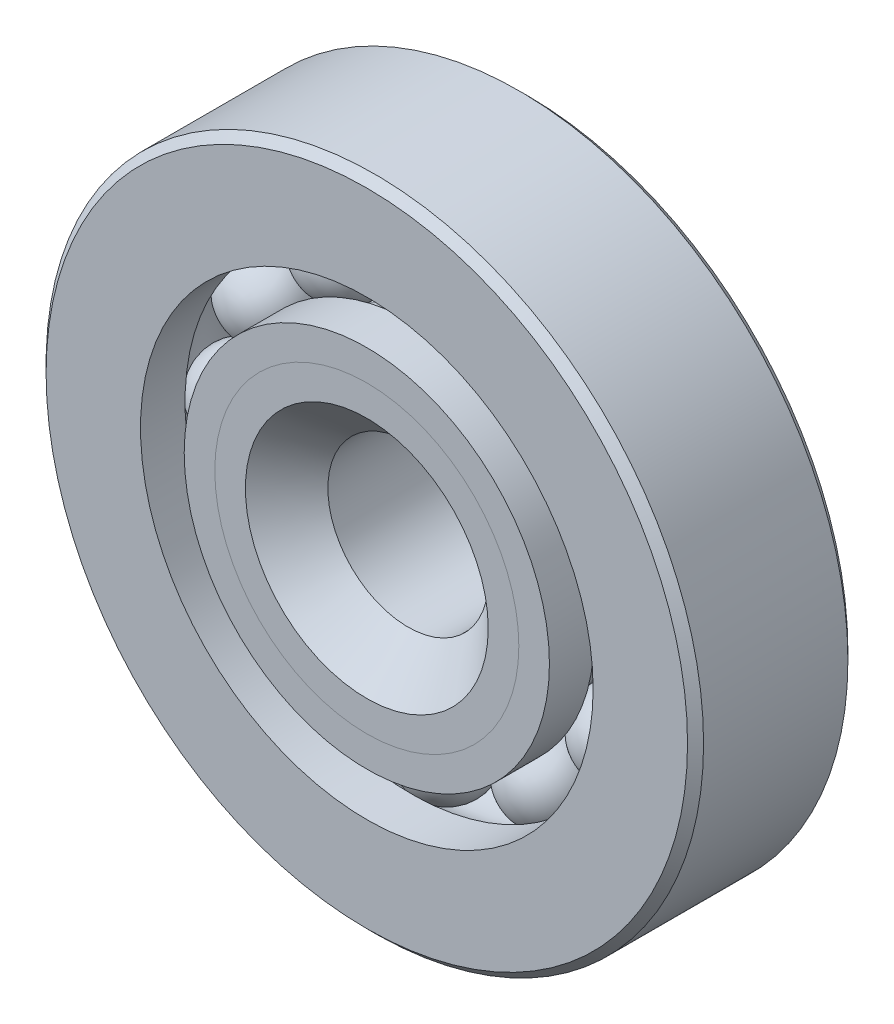
from build123d import *

# Parameters (mm, degrees)
CIRPATTERN1_COUNT = 12


with BuildPart() as part:
    # Sketch1 → Revolve1 (revolve)
    with BuildSketch(Plane(origin=(0, 0, 0), x_dir=(0, 0, -1), z_dir=(1, 0, 0))):
        with BuildLine():
            Line((3.571875, 16.271875), (-3.571875, 16.271875))
            Line((-3.571875, 16.271875), (-3.96875, 15.875))
            Line((-3.96875, 15.875), (-3.96875, 11.201905907))
            Line((-3.96875, 11.201905907), (-1.763888889, 11.201905907))
            ThreePointArc((-1.763888889, 11.201905907), (0, 12.189406096), (1.763888889, 11.201905907))
            Line((1.763888889, 11.201905907), (3.96875, 11.201905907))
            Line((3.96875, 11.201905907), (3.96875, 15.875))
            Line((3.96875, 15.875), (3.571875, 16.271875))
        make_face()
    revolve(axis=Axis((0, 0, 3.96875), (0, 0, -1)))


with BuildPart() as body_2:
    # Sketch2 → Revolve2 (revolve)
    with BuildSketch(Plane(origin=(0, 0, 0), x_dir=(0, 0, -1), z_dir=(1, 0, 0))):
        with BuildLine():
            Line((-3.96875, 9.038719093), (-1.763888889, 9.038719093))
            ThreePointArc((-1.763888889, 9.038719093), (-1.0107498, 8.314894778), (0, 8.051218904))
            Line((0, 8.051218904), (0, 6.009984452))
            Line((0, 6.009984452), (-2.454382679, 6.009984452))
            Line((-2.454382679, 6.009984452), (-3.96875, 7.524351773))
            Line((-3.96875, 7.524351773), (-3.96875, 9.038719093))
        make_face()
    revolve(axis=Axis((0, 0, 3.96875), (0, 0, -1)))


with BuildPart() as body_3:
    # Sketch3 → Revolve3 (revolve)
    with BuildSketch(Plane(origin=(0, 0, 0), x_dir=(0, 0, -1), z_dir=(1, 0, 0))):
        with BuildLine():
            Line((-3.96875, 7.524351773), (-2.454382679, 6.009984452))
            Line((-2.454382679, 6.009984452), (0, 6.009984452))
            Line((0, 6.009984452), (0, 8.051218904))
            ThreePointArc((0, 8.051218904), (1.0107498, 8.314894778), (1.763888889, 9.038719093))
            Line((1.763888889, 9.038719093), (3.96875, 9.038719093))
            Line((3.96875, 9.038719093), (3.96875, 4.365625))
            Line((3.96875, 4.365625), (3.571875, 3.96875))
            Line((3.571875, 3.96875), (-1.927515548, 3.96875))
            Line((-1.927515548, 3.96875), (-3.96875, 6.009984452))
            Line((-3.96875, 6.009984452), (-3.96875, 7.524351773))
        make_face()
    revolve(axis=Axis((0, 0, 3.96875), (0, 0, -1)))


with BuildPart() as body_4:
    # Sketch4 → Revolve4 (revolve)
    with BuildSketch(Plane(origin=(0, 0, 0), x_dir=(0, 0, -1), z_dir=(1, 0, 0))):
        with BuildLine():
            Line((-2.069093596, 10.1203125), (2.069093596, 10.1203125))
            ThreePointArc((2.069093596, 10.1203125), (0, 12.189406096), (-2.069093596, 10.1203125))
        make_face()
    revolve(axis=Axis((0, 10.1203125, 2.069093596), (0, 0, -1)))


with BuildPart() as cirpattern1_1:
    # CirPattern1: pattern copy
    add(body_4.part.rotate(Axis((0, 0, -3.96875), (0, 0, 1)), 1 * 360 / CIRPATTERN1_COUNT))


with BuildPart() as cirpattern1_2:
    # CirPattern1: pattern copy
    add(body_4.part.rotate(Axis((0, 0, -3.96875), (0, 0, 1)), 2 * 360 / CIRPATTERN1_COUNT))


with BuildPart() as cirpattern1_3:
    # CirPattern1: pattern copy
    add(body_4.part.rotate(Axis((0, 0, -3.96875), (0, 0, 1)), 3 * 360 / CIRPATTERN1_COUNT))


with BuildPart() as cirpattern1_4:
    # CirPattern1: pattern copy
    add(body_4.part.rotate(Axis((0, 0, -3.96875), (0, 0, 1)), 4 * 360 / CIRPATTERN1_COUNT))


with BuildPart() as cirpattern1_5:
    # CirPattern1: pattern copy
    add(body_4.part.rotate(Axis((0, 0, -3.96875), (0, 0, 1)), 5 * 360 / CIRPATTERN1_COUNT))


with BuildPart() as cirpattern1_6:
    # CirPattern1: pattern copy
    add(body_4.part.rotate(Axis((0, 0, -3.96875), (0, 0, 1)), 6 * 360 / CIRPATTERN1_COUNT))


with BuildPart() as cirpattern1_7:
    # CirPattern1: pattern copy
    add(body_4.part.rotate(Axis((0, 0, -3.96875), (0, 0, 1)), 7 * 360 / CIRPATTERN1_COUNT))


with BuildPart() as cirpattern1_8:
    # CirPattern1: pattern copy
    add(body_4.part.rotate(Axis((0, 0, -3.96875), (0, 0, 1)), 8 * 360 / CIRPATTERN1_COUNT))


with BuildPart() as cirpattern1_9:
    # CirPattern1: pattern copy
    add(body_4.part.rotate(Axis((0, 0, -3.96875), (0, 0, 1)), 9 * 360 / CIRPATTERN1_COUNT))


with BuildPart() as cirpattern1_10:
    # CirPattern1: pattern copy
    add(body_4.part.rotate(Axis((0, 0, -3.96875), (0, 0, 1)), 10 * 360 / CIRPATTERN1_COUNT))


with BuildPart() as cirpattern1_11:
    # CirPattern1: pattern copy
    add(body_4.part.rotate(Axis((0, 0, -3.96875), (0, 0, 1)), 11 * 360 / CIRPATTERN1_COUNT))


solid = Compound([part.part, body_2.part, body_3.part, body_4.part, cirpattern1_1.part, cirpattern1_2.part, cirpattern1_3.part, cirpattern1_4.part, cirpattern1_5.part, cirpattern1_6.part, cirpattern1_7.part, cirpattern1_8.part, cirpattern1_9.part, cirpattern1_10.part, cirpattern1_11.part])
